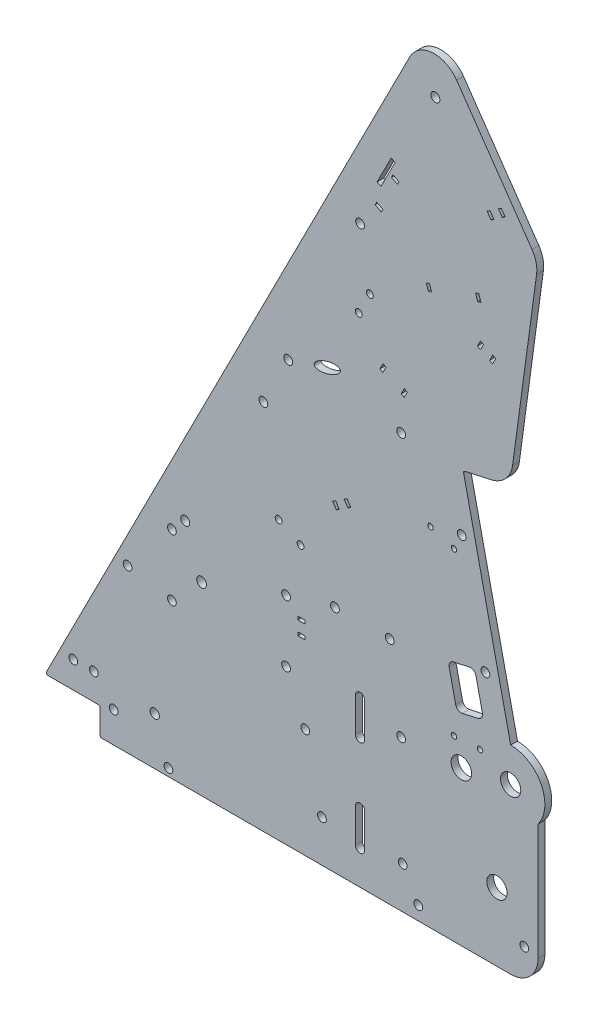
from build123d import *

# Parameters (mm, degrees)
BOSS_EXTRUDE1_DEPTH     = 3.175
SKETCH2_R               = 2.0955
SKETCH2_R_2             = 2.286
SKETCH2_R_3             = 2.032
SKETCH2_R_4             = 4.699
CUT_EXTRUDE1_DEPTH      = 421.976111717
SKETCH7_R               = 2.159
CUT_EXTRUDE2_DEPTH      = 421.976111717
CUT_EXTRUDE3_REACH      = 422.976
SKETCH10_R              = 2.032
FILLET1_R               = 12.7
FILLET2_R               = 0.79375
SKETCH12_R              = 2.032
CUT_EXTRUDE5_DEPTH      = 411.989226146
SKETCH13_R              = 2.032
SKETCH13_R_2            = 1.6
SKETCH13_RX             = 6.35
SKETCH13_RY             = 2.38125
SKETCH13_W              = 3.175
SKETCH13_H              = 1.5875
CUT_EXTRUDE6_DEPTH      = 411.989226146
CUT_EXTRUDE7_DEPTH      = 411.989226285
CUT_EXTRUDE7_DEPTH_BACK = 411.989226285
SKETCH14_R              = 1.27
SKETCH14_R_2            = 2.032
FILLET3_R               = 2.54
SKETCH15_R              = 4.7625
CUT_EXTRUDE8_DEPTH      = 411.989226285


with BuildPart() as part:
    # Sketch1 → Boss-Extrude1 (new body)
    with BuildSketch(Plane.XY):
        with BuildLine():
            Line((228.6, -12.7), (228.6, 53.975))
            ThreePointArc((228.6, 53.975), (230.099031657, 70.599515829), (215.9, 79.375))
            Line((215.9, 79.375), (193.909735224, 178.566674323))
            Line((193.909735224, 178.566674323), (215.607913982, 183.377044743))
            Line((215.607913982, 183.377044743), (228.6, 279.4))
            Line((228.6, 279.4), (178.754725958, 351.413083686))
            Line((178.754725958, 351.413083686), (0, 0))
            Line((0, 0), (25.4, 0))
            Line((25.4, 0), (25.4, -12.7))
            Line((25.4, -12.7), (228.6, -12.7))
        make_face()
    extrude(amount=BOSS_EXTRUDE1_DEPTH)

    # Sketch2 → Cut-Extrude1 (cut, through all)
    with BuildSketch(Plane.XY.offset(3.175)):
        with Locations((64.943150167, 94.057839899)):
            Circle(SKETCH2_R)
        with Locations((180.975, 322.164313376)):
            Circle(SKETCH2_R)
        with Locations((72.544547852, 73.173171402)):
            Circle(SKETCH2_R_2)
        with Locations((193.207821773, 152.394364194)):
            Circle(SKETCH2_R_3)
        with Locations((215.9, 63.5)):
            Circle(SKETCH2_R_4)
        with Locations((173.0375, -6.35)):
            Circle(SKETCH2_R_3)
        with Locations((204.202954161, 102.798527032)):
            Circle(SKETCH2_R_3)
        with Locations((209.55, 19.05)):
            Circle(SKETCH2_R_4)
        with Locations((165.1, 179.3875)):
            Circle(SKETCH2_R_3)
        with Locations((111.724047852, 87.460671402)):
            Circle(SKETCH2_R_3)
        with Locations((111.724047852, 58.885671402)):
            Circle(SKETCH2_R_3)
        with Locations((58.765047852, 58.885671402)):
            Circle(SKETCH2_R_3)
        with Locations((58.765047852, 87.460671402)):
            Circle(SKETCH2_R_3)
    extrude(amount=-CUT_EXTRUDE1_DEPTH, mode=Mode.SUBTRACT)

    # Sketch7 → Cut-Extrude2 (cut, through all)
    with BuildSketch(Plane.XY.offset(3.175)):
        with Locations((50.8, 9.525)):
            Circle(SKETCH7_R)
        with BuildLine():
            Line((143.891, 3.175), (143.891, 19.05))
            ThreePointArc((143.891, 19.05), (146.05, 21.209), (148.209, 19.05))
            Line((148.209, 19.05), (148.209, 3.175))
            ThreePointArc((148.209, 3.175), (146.05, 1.016), (143.891, 3.175))
        make_face()
        with BuildLine():
            Line((143.891, 47.625), (143.891, 63.5))
            ThreePointArc((143.891, 63.5), (146.05, 65.659), (148.209, 63.5))
            Line((148.209, 63.5), (148.209, 47.625))
            ThreePointArc((148.209, 47.625), (146.05, 45.466), (143.891, 47.625))
        make_face()
    extrude(amount=-CUT_EXTRUDE2_DEPTH, mode=Mode.SUBTRACT)

    # Sketch10 → Cut-Extrude3 (cut, up to next)
    with BuildSketch(Plane.XY.offset(3.175), mode=Mode.PRIVATE) as cut_extrude3_sk1:
        with Locations((120.65, 38.1)):
            Circle(SKETCH10_R)
    cut_extrude3_tool1 = extrude(cut_extrude3_sk1.sketch, amount=-CUT_EXTRUDE3_REACH, mode=Mode.PRIVATE) & part.part
    # Sketch10 → Cut-Extrude3 (cut, up to next)
    with BuildSketch(Plane.XY.offset(3.175), mode=Mode.PRIVATE) as cut_extrude3_sk2:
        with Locations((165.1, 57.15)):
            Circle(SKETCH10_R)
    cut_extrude3_tool2 = extrude(cut_extrude3_sk2.sketch, amount=-CUT_EXTRUDE3_REACH, mode=Mode.PRIVATE) & part.part
    # Sketch10 → Cut-Extrude3 (cut, up to next)
    with BuildSketch(Plane.XY.offset(3.175), mode=Mode.PRIVATE) as cut_extrude3_sk3:
        with Locations((13.046467246, 12.334704411)):
            Circle(SKETCH10_R)
    cut_extrude3_tool3 = extrude(cut_extrude3_sk3.sketch, amount=-CUT_EXTRUDE3_REACH, mode=Mode.PRIVATE) & part.part
    # Sketch10 → Cut-Extrude3 (cut, up to next)
    with BuildSketch(Plane.XY.offset(3.175), mode=Mode.PRIVATE) as cut_extrude3_sk4:
        with Locations((22.571467246, 12.334704411)):
            Circle(SKETCH10_R)
    cut_extrude3_tool4 = extrude(cut_extrude3_sk4.sketch, amount=-CUT_EXTRUDE3_REACH, mode=Mode.PRIVATE) & part.part
    # Sketch10 → Cut-Extrude3 (cut, up to next)
    with BuildSketch(Plane.XY.offset(3.175), mode=Mode.PRIVATE) as cut_extrude3_sk5:
        with Locations((38.211447917, 62.639810909)):
            Circle(SKETCH10_R)
    cut_extrude3_tool5 = extrude(cut_extrude3_sk5.sketch, amount=-CUT_EXTRUDE3_REACH, mode=Mode.PRIVATE) & part.part
    add(cut_extrude3_tool1.solids().sort_by_distance((120.65, 38.1, 3.175))[0], mode=Mode.SUBTRACT)
    add(cut_extrude3_tool2.solids().sort_by_distance((165.1, 57.15, 3.175))[0], mode=Mode.SUBTRACT)
    add(cut_extrude3_tool3.solids().sort_by_distance((13.046467, 12.334704, 3.175))[0], mode=Mode.SUBTRACT)
    add(cut_extrude3_tool4.solids().sort_by_distance((22.571467, 12.334704, 3.175))[0], mode=Mode.SUBTRACT)
    add(cut_extrude3_tool5.solids().sort_by_distance((38.211448, 62.639811, 3.175))[0], mode=Mode.SUBTRACT)

    # Fillet1
    fillet1_edges = [part.edges().sort_by_distance(p)[0] for p in [
        (178.754725958, 351.413083686, 1.5875),
        (228.6, 279.4, 1.5875),
        (215.607913982, 183.377044743, 1.5875),
        (228.6, -12.7, 1.5875),
    ]]
    fillet(fillet1_edges, radius=FILLET1_R)

    # Fillet2
    fillet2_edges = [part.edges().sort_by_distance(p)[0] for p in [
        (25.4, -12.7, 1.5875),
        (25.4, 0, 1.5875),
        (0, 0, 1.5875),
        (193.909735224, 178.566674323, 1.5875),
    ]]
    fillet(fillet2_edges, radius=FILLET2_R)

    # Sketch12 → Cut-Extrude5 (cut, through all)
    with BuildSketch(Plane.XY.offset(3.175)):
        with Locations((31.75, 1.5875)):
            Circle(SKETCH12_R)
        with Locations((173.0375, -6.35)):
            Circle(SKETCH12_R)
        with Locations((222.25, 1.5875)):
            Circle(SKETCH12_R)
        with Locations((57.15, -9.2075)):
            Circle(SKETCH12_R)
    extrude(amount=-CUT_EXTRUDE5_DEPTH, mode=Mode.SUBTRACT)

    # Sketch13 → Cut-Extrude6 (cut, through all)
    with BuildSketch(Plane.XY.offset(3.175)):
        with Locations((112.7125, 182.5625)):
            Circle(SKETCH13_R)
        with Locations((146.05, 254)):
            Circle(SKETCH13_R)
        with Locations((101.196445848, 159.923142748)):
            Circle(SKETCH13_R)
        with Locations((145.425401673, 217.737567824)):
            Circle(SKETCH13_R_2)
        with Locations((150.594024403, 227.898539189)):
            Circle(SKETCH13_R_2)
        with Locations((108.294003262, 116.150198589)):
            Circle(SKETCH13_R_2)
        with Locations((118.454974627, 110.981575859)):
            Circle(SKETCH13_R_2)
        with Locations(Location((130.826142263, 188.461522288), (0, 0, 18.038739462))):
            Ellipse(SKETCH13_RX, SKETCH13_RY)
        Polygon((178.26972852, 245.992253978), (176.758236028, 245.506922447), (177.728899089, 242.483937462), (179.240391581, 242.969268992), align=None)
        Polygon((153.938079759, 274.614823847), (160.502230626, 287.51925748), (162.284857181, 286.612481563), (155.720706315, 273.708047929), align=None)
        Polygon((200.609634347, 249.830809719), (202.12112684, 250.316141249), (201.150463779, 253.339126235), (199.638971286, 252.853794704), align=None)
        Polygon((160.590482388, 279.78010172), (163.420402045, 278.340594951), (164.140155429, 279.75555478), (161.310235773, 281.195061549), align=None)
        Polygon((153.789663007, 266.410402556), (153.069909623, 264.995442728), (155.899829279, 263.555935959), (156.619582664, 264.970895787), align=None)
        Polygon((203.330342332, 234.029927366), (201.915382504, 234.74968075), (200.475875735, 231.919761094), (201.890835563, 231.200007709), align=None)
        Polygon((206.135715047, 229.040747556), (207.550674876, 228.320994171), (208.990181645, 231.150913828), (207.575221816, 231.870667212), align=None)
        Polygon((211.540543439, 292.889033628), (210.235229039, 291.98553456), (212.042227175, 289.374905759), (213.347541575, 290.278404827), align=None)
        Polygon((206.319285837, 289.275037356), (205.013971437, 288.371538288), (206.820969573, 285.760909487), (208.126283974, 286.664408555), align=None)
        Polygon((133.35043444, 136.102010662), (135.081463368, 133.440401403), (136.412267998, 134.305915867), (134.681239069, 136.967525126), align=None)
        Polygon((155.228084113, 200.119678264), (156.643043941, 199.39992488), (158.08255071, 202.229844536), (156.667590882, 202.949597921), align=None)
        Polygon((165.132802911, 195.081404573), (166.547762739, 194.361651188), (167.987269508, 197.191570845), (166.57230968, 197.911324229), align=None)
        Polygon((140.404681887, 136.90245926), (138.673652958, 139.564068519), (140.004457588, 140.429582984), (141.735486516, 137.767973724), align=None)
        with Locations((118.836047852, 81.078921402)):
            Rectangle(SKETCH13_W, SKETCH13_H)
        with Locations((118.836047852, 74.728921402)):
            Rectangle(SKETCH13_W, SKETCH13_H)
    extrude(amount=-CUT_EXTRUDE6_DEPTH, mode=Mode.SUBTRACT)

    # Sketch14 → Cut-Extrude7 (cut, two sides: drawn at the far end of the back side and taken through both)
    with BuildSketch(Plane.XY.offset(3.175).offset(-CUT_EXTRUDE7_DEPTH_BACK)):
        with Locations((189.602197334, 69.980636704)):
            Circle(SKETCH14_R)
        with Locations((201.708862449, 70.509225118)):
            Circle(SKETCH14_R)
        with Locations((159.793547852, 93.98)):
            Circle(SKETCH14_R_2)
        with Locations((134.393547852, 93.98)):
            Circle(SKETCH14_R_2)
        with Locations((178.721644858, 148.532438598)):
            Circle(SKETCH14_R)
        with Locations((189.622629605, 145.09537131)):
            Circle(SKETCH14_R)
        with Locations((128.361047852, 6.6675)):
            Circle(SKETCH14_R_2)
        with Locations((165.826047852, 6.6675)):
            Circle(SKETCH14_R_2)
        Polygon((186.844411154, 98.950230697), (199.243370445, 101.699013794), (203.36654509, 83.100574858), (190.9675858, 80.351791761), align=None)
    extrude(amount=CUT_EXTRUDE7_DEPTH + CUT_EXTRUDE7_DEPTH_BACK, mode=Mode.SUBTRACT)

    # Fillet3
    fillet3_edges = [part.edges().sort_by_distance(p)[0] for p in [
        (199.243370445, 101.699013794, 1.5875),
        (203.36654509, 83.100574858, 1.5875),
        (190.9675858, 80.351791761, 1.5875),
        (186.844411154, 98.950230697, 1.5875),
    ]]
    fillet(fillet3_edges, radius=FILLET3_R)

    # Sketch15 → Cut-Extrude8 (cut, through all)
    with BuildSketch(Plane.XY.offset(3.175)):
        with Locations((193.04, 58.801)):
            Circle(SKETCH15_R)
    extrude(amount=-CUT_EXTRUDE8_DEPTH, mode=Mode.SUBTRACT)


solid = part.part
